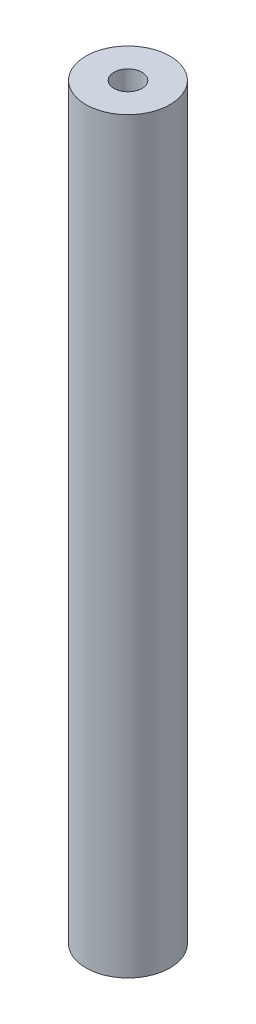
from build123d import *

# Parameters (mm, degrees)
SKETCH_1_R          = 4.5
EXTRUDE_1_DEPTH     = 80
SKETCH_2_R          = 1.5
CUT_EXTRUDE_1_DEPTH = 10
CUT_EXTRUDE_START   = -10
SKETCH_3_R          = 1.5
CUT_EXTRUDE_2_DEPTH = 10


with BuildPart() as part:
    # 草图1 → 凸台-拉伸1 (new body)
    with BuildSketch(Plane(origin=(0, 0, 0), x_dir=(1, 0, 0), z_dir=(0, 1, 0))):
        with Locations(Location((0, 0, 0), (0, 0, 270))):
            Circle(SKETCH_1_R)
    extrude(amount=EXTRUDE_1_DEPTH)

    # 草图2 → 切除-拉伸1 (cut)
    with BuildSketch(Plane(origin=(0, 80, 0), x_dir=(1, 0, 0), z_dir=(0, 1, 0))):
        with Locations(Location((0, 0, 0), (0, 0, 270))):
            Circle(SKETCH_2_R)
    extrude(amount=-CUT_EXTRUDE_1_DEPTH, mode=Mode.SUBTRACT)

    # 草图3 → 切除-拉伸2 (cut)
    with BuildSketch(Plane.XZ.offset(CUT_EXTRUDE_START)):
        with Locations(Location((0, 0, 0), (0, 0, 90))):
            Circle(SKETCH_3_R)
    extrude(amount=CUT_EXTRUDE_2_DEPTH, mode=Mode.SUBTRACT)


solid = part.part
